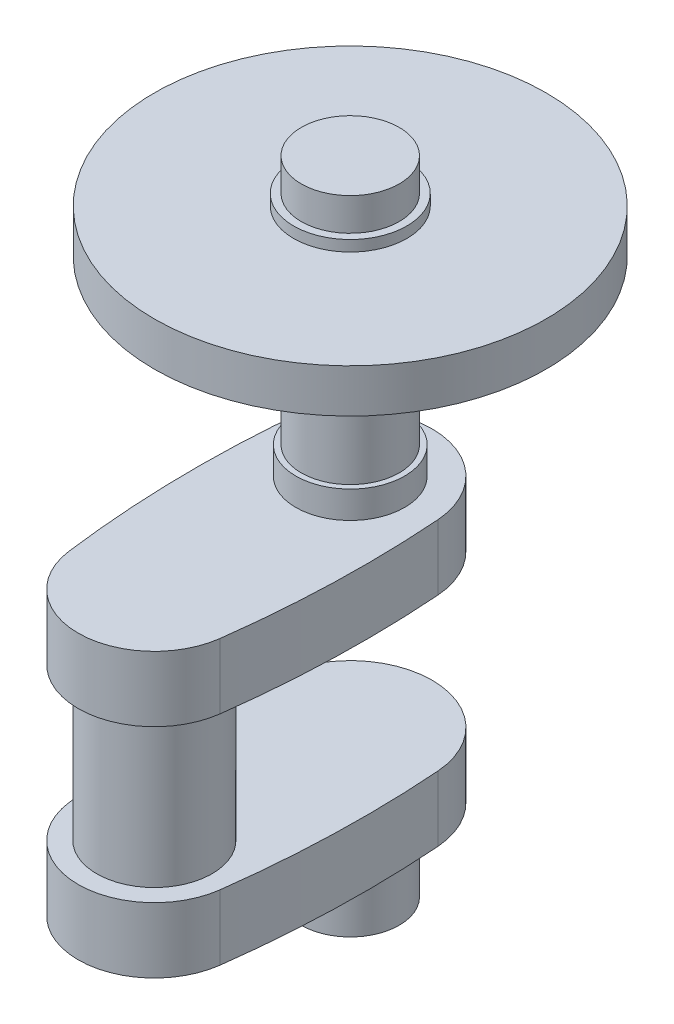
from build123d import *

# Parameters (mm, degrees)
SKETCH1_R           = 22.5
BOSS_EXTRUDE1_DEPTH = 25
SKETCH2_R           = 25
BOSS_EXTRUDE2_DEPTH = 12.5
BOSS_EXTRUDE3_DEPTH = 30
SKETCH4_R           = 26.5
BOSS_EXTRUDE4_DEPTH = 35
SKETCH5_R           = 22.5
BOSS_EXTRUDE5_DEPTH = 50
SKETCH6_R           = 90
BOSS_EXTRUDE6_DEPTH = 20
SKETCH7_R           = 22.5
BOSS_EXTRUDE7_DEPTH = 20
SKETCH8_R           = 26
BOSS_EXTRUDE8_DEPTH = 5
BOSS_EXTRUDE9_START = 5
SKETCH9_R           = 26
BOSS_EXTRUDE9_DEPTH = 5


with BuildPart() as part:
    # Sketch1 → Boss-Extrude1 (new body)
    with BuildSketch(Plane(origin=(0, 0, 0), x_dir=(1, 0, 0), z_dir=(0, 1, 0))):
        with Locations(Location((0, 0, 0), (0, 0, 270))):
            Circle(SKETCH1_R)
    extrude(amount=BOSS_EXTRUDE1_DEPTH)

    # Sketch2 → Boss-Extrude2 (add)
    with BuildSketch(Plane(origin=(0, 0, 0), x_dir=(1, 0, 0), z_dir=(0, 1, 0))):
        with Locations(Location((0, 0, 0), (0, 0, 270))):
            Circle(SKETCH2_R)
    extrude(amount=-BOSS_EXTRUDE2_DEPTH)

    # Sketch3 → Boss-Extrude3 (add)
    with BuildSketch(Plane.XZ.offset(12.5)):
        with BuildLine():
            ThreePointArc((-37.5, -2.740437921), (0, -37.6), (37.5, -2.740437921))
            ThreePointArc((37.5, -2.740437921), (38.576956863, 45.97711937), (34.702685351, 94.552321322))
            ThreePointArc((34.702685351, 94.552321322), (0, 125), (-34.702685351, 94.552321322))
            ThreePointArc((-34.702685351, 94.552321322), (-38.576956863, 45.97711937), (-37.5, -2.740437921))
        make_face()
    extrude(amount=BOSS_EXTRUDE3_DEPTH)

    # Sketch4 → Boss-Extrude4 (add)
    with BuildSketch(Plane.XZ.offset(42.5)):
        with Locations(Location((0, 90, 0), (0, 0, 270))):
            Circle(SKETCH4_R)
    extrude(amount=BOSS_EXTRUDE4_DEPTH)

    # Mirror1: part across plane


with BuildPart() as part_1:
    add(part.part)
    add(part.part.mirror(Plane(origin=(0, -77.5, 90), x_dir=(0, 0, 1), z_dir=(0, -1, 0))))

    # Sketch5 → Boss-Extrude5 (add)
    with BuildSketch(Plane(origin=(0, 25, 0), x_dir=(1, 0, 0), z_dir=(0, 1, 0))):
        with Locations(Location((0, 0, 0), (0, 0, 270))):
            Circle(SKETCH5_R)
    extrude(amount=BOSS_EXTRUDE5_DEPTH)

    # Sketch6 → Boss-Extrude6 (add)
    with BuildSketch(Plane(origin=(0, 75, 0), x_dir=(1, 0, 0), z_dir=(0, 1, 0))):
        with Locations(Location((0, 0, 0), (0, 0, 270))):
            Circle(SKETCH6_R)
    extrude(amount=BOSS_EXTRUDE6_DEPTH)

    # Sketch7 → Boss-Extrude7 (add)
    with BuildSketch(Plane(origin=(0, 95, 0), x_dir=(1, 0, 0), z_dir=(0, 1, 0))):
        with Locations(Location((0, 0, 0), (0, 0, 270))):
            Circle(SKETCH7_R)
    extrude(amount=BOSS_EXTRUDE7_DEPTH)

    # Sketch8 → Boss-Extrude8 (add)
    with BuildSketch(Plane.XZ.offset(-75)):
        with Locations(Location((0, 0, 0), (0, 0, 90))):
            Circle(SKETCH8_R)
    extrude(amount=BOSS_EXTRUDE8_DEPTH)

    # Sketch9 → Boss-Extrude9 (add)
    with BuildSketch(Plane(origin=(0, 95, 0), x_dir=(1, 0, 0), z_dir=(0, 1, 0)).offset(BOSS_EXTRUDE9_START)):
        with Locations(Location((0, 0, 0), (0, 0, 270))):
            Circle(SKETCH9_R)
    extrude(amount=-BOSS_EXTRUDE9_DEPTH)


solid = part_1.part
